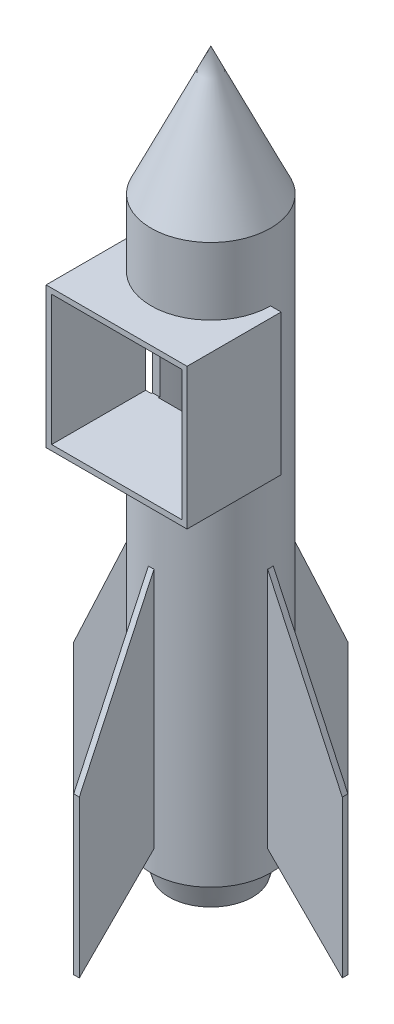
from build123d import *

# Parameters (mm, degrees)
BOSS_EXTRUDE1_DEPTH     = 0.5953125
CIRPATTERN1_COUNT       = 4
SKETCH6_W               = 30
SKETCH6_H               = 30
BOSS_EXTRUDE2_DEPTH     = 20
CUT_EXTRUDE2_DEPTH      = 25.636
CUT_EXTRUDE2_DEPTH_BACK = 0.254
SKETCH8_W               = 27.7
SKETCH8_H               = 27.7


with BuildPart() as part:
    # Sketch1 → Revolve2 (revolve)
    with BuildSketch(Plane.XY):
        Polygon((0, 0), (0, 152.4), (12.7, 125.16476211), (12.7, 6.35), (10.80240754, 6.35), (8.89, 0), align=None)
    revolve(axis=Axis((0, -1000, 0), (0, 1, 0)))

    # Sketch3 → Boss-Extrude1 (add, symmetric)
    with BuildSketch(Plane.XY):
        Polygon((11.1125, 66.023452099), (28.575, 28.575), (28.575, -4.7625), (11.1125, 12.7), align=None)
    boss_extrude1 = extrude(amount=BOSS_EXTRUDE1_DEPTH, both=True)

    # CirPattern1: Boss-Extrude1 ×4 about axis
    cirpattern1_axis = Axis((0, -12.620625, 0), (0, 1, 0))
    for i in range(1, CIRPATTERN1_COUNT):
        add(boss_extrude1.rotate(cirpattern1_axis, i * 360 / CIRPATTERN1_COUNT))

    # Sketch5 → Cut-Revolve1 (revolve, cut)
    with BuildSketch(Plane.XY):
        Polygon((0, 95.25), (0, 0), (8.061034129, 0), (11.1125, 10.132154301), (11.1125, 95.25), align=None)
    revolve(axis=Axis((0, -1000, 0), (0, 1, 0)), mode=Mode.SUBTRACT)

    # Sketch6 → Boss-Extrude2 (add)
    with BuildSketch(Plane(origin=(-5.901898503, 3.807192265, 0), x_dir=(1, 0, 0), z_dir=(0, 0, 1))):
        with Locations((5.85297619, 92.047729896)):
            Rectangle(SKETCH6_W, SKETCH6_H)
    extrude(amount=BOSS_EXTRUDE2_DEPTH)

    # Sketch8 → Cut-Extrude2 (cut, two sides: drawn at the far end of the back side and taken through both)
    with BuildSketch(Plane(origin=(72.442949274, -2.579929792, 0), x_dir=(1, 0, 0), z_dir=(0, 0, 1)).offset(-CUT_EXTRUDE2_DEPTH_BACK)):
        with Locations((-72.46037851, 98.457547314)):
            Rectangle(SKETCH8_W, SKETCH8_H)
    extrude(amount=CUT_EXTRUDE2_DEPTH + CUT_EXTRUDE2_DEPTH_BACK, mode=Mode.SUBTRACT)


solid = part.part
